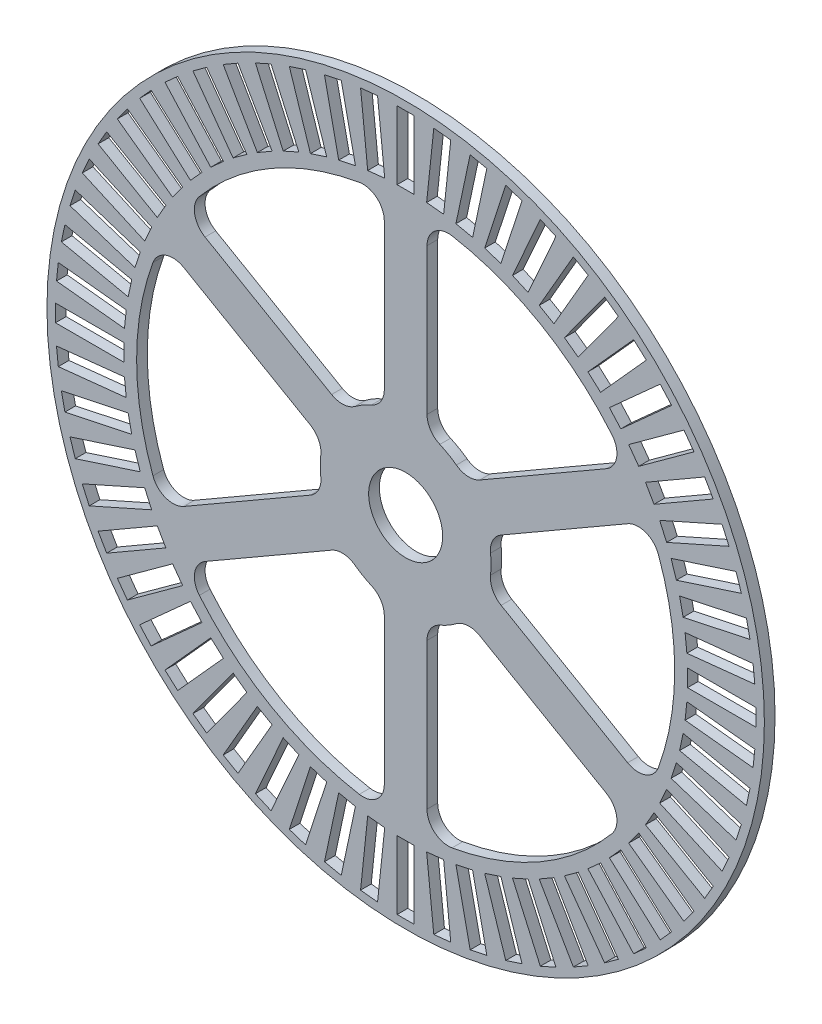
from build123d import *

# Parameters (mm, degrees)
SKETCH1_R           = 53.34
SKETCH1_R_2         = 40.005
BOSS_EXTRUDE1_DEPTH = 1.5875
SKETCH4_W           = 2.54
SKETCH4_H           = 10.16
CUT_EXTRUDE3_DEPTH  = 5.08
CIRPATTERN2_COUNT   = 60
SKETCH8_R           = 5.5
BOSS_EXTRUDE2_DEPTH = 1.5875
FILLET1_R           = 3.175


with BuildPart() as part:
    # Sketch1 → Boss-Extrude1 (new body)
    with BuildSketch(Plane.XY):
        Circle(SKETCH1_R)
        Circle(SKETCH1_R_2, mode=Mode.SUBTRACT)
    extrude(amount=BOSS_EXTRUDE1_DEPTH)

    # Sketch4 → Cut-Extrude3 (cut)
    with BuildSketch(Plane.XY.offset(1.5875)):
        with Locations((0, 46.99)):
            Rectangle(SKETCH4_W, SKETCH4_H)
    cut_extrude3 = extrude(amount=-CUT_EXTRUDE3_DEPTH, mode=Mode.SUBTRACT)

    # CirPattern2: Cut-Extrude3 ×60 about axis
    cirpattern2_axis = Axis((0, 0, 1.5875), (0, 0, 1))
    for i in range(1, CIRPATTERN2_COUNT):
        add(cut_extrude3.rotate(cirpattern2_axis, i * 360 / CIRPATTERN2_COUNT), mode=Mode.SUBTRACT)

    # Sketch8 → Boss-Extrude2 (add)
    with BuildSketch(Plane.XY):
        with BuildLine():
            Line((-3.175, 12.296722124), (-3.175, 39.878808909))
            ThreePointArc((-3.175, 39.878808909), (0, 40.005), (3.175, 39.878808909))
            Line((3.175, 39.878808909), (3.175, 12.296722124))
            ThreePointArc((3.175, 12.296722124), (6.35, 10.998522628), (9.061773743, 8.897991719))
            Line((9.061773743, 8.897991719), (32.948561588, 22.689035112))
            ThreePointArc((32.948561588, 22.689035112), (34.645346278, 20.0025), (36.123561588, 17.189773797))
            Line((36.123561588, 17.189773797), (12.236773743, 3.398730405))
            ThreePointArc((12.236773743, 3.398730405), (12.7, 0), (12.236773743, -3.398730405))
            Line((12.236773743, -3.398730405), (36.123561588, -17.189773797))
            ThreePointArc((36.123561588, -17.189773797), (34.645346278, -20.0025), (32.948561588, -22.689035112))
            Line((32.948561588, -22.689035112), (9.061773743, -8.897991719))
            ThreePointArc((9.061773743, -8.897991719), (6.35, -10.998522628), (3.175, -12.296722124))
            Line((3.175, -12.296722124), (3.175, -39.878808909))
            ThreePointArc((3.175, -39.878808909), (0, -40.005), (-3.175, -39.878808909))
            Line((-3.175, -39.878808909), (-3.175, -12.296722124))
            ThreePointArc((-3.175, -12.296722124), (-6.35, -10.998522628), (-9.061773743, -8.897991719))
            Line((-9.061773743, -8.897991719), (-32.948561588, -22.689035112))
            ThreePointArc((-32.948561588, -22.689035112), (-34.645346278, -20.0025), (-36.123561588, -17.189773797))
            Line((-36.123561588, -17.189773797), (-12.236773743, -3.398730405))
            ThreePointArc((-12.236773743, -3.398730405), (-12.7, 0), (-12.236773743, 3.398730405))
            Line((-12.236773743, 3.398730405), (-36.123561588, 17.189773797))
            ThreePointArc((-36.123561588, 17.189773797), (-34.645346278, 20.0025), (-32.948561588, 22.689035112))
            Line((-32.948561588, 22.689035112), (-9.061773743, 8.897991719))
            ThreePointArc((-9.061773743, 8.897991719), (-6.35, 10.998522628), (-3.175, 12.296722124))
        make_face()
        Circle(SKETCH8_R, mode=Mode.SUBTRACT)
    extrude(amount=BOSS_EXTRUDE2_DEPTH)

    # Fillet1
    fillet1_edges = [part.edges().sort_by_distance(p)[0] for p in [
        (12.236773743, -3.398730405, 0.79375),
        (12.236773743, 3.398730405, 0.79375),
        (9.061773743, -8.897991719, 0.79375),
        (3.175, -12.296722124, 0.79375),
        (-3.175, -12.296722124, 0.79375),
        (-9.061773743, -8.897991719, 0.79375),
        (-12.236773743, 3.398730405, 0.79375),
        (-12.236773743, -3.398730405, 0.79375),
        (-3.175, 12.296722124, 0.79375),
        (-9.061773743, 8.897991719, 0.79375),
        (3.175, 12.296722124, 0.79375),
        (9.061773743, 8.897991719, 0.79375),
        (3.175, 39.878808909, 0.79375),
        (32.948561588, 22.689035112, 0.79375),
        (36.123561588, 17.189773797, 0.79375),
        (36.123561588, -17.189773797, 0.79375),
        (32.948561588, -22.689035112, 0.79375),
        (3.175, -39.878808909, 0.79375),
        (-3.175, -39.878808909, 0.79375),
        (-32.948561588, -22.689035112, 0.79375),
        (-36.123561588, -17.189773797, 0.79375),
        (-36.123561588, 17.189773797, 0.79375),
        (-32.948561588, 22.689035112, 0.79375),
        (-3.175, 39.878808909, 0.79375),
    ]]
    fillet(fillet1_edges, radius=FILLET1_R)


solid = part.part
